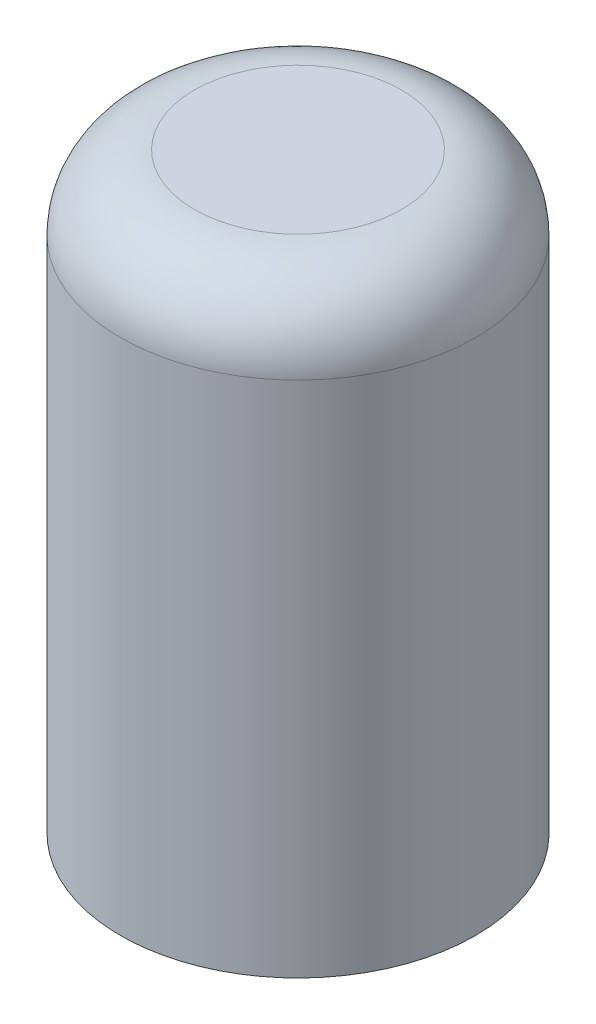
from build123d import *

# Parameters (mm, degrees)
SHELL5_T = -2


with BuildPart() as part:
    # Sketch1 → Revolve5 (revolve)
    with BuildSketch(Plane.XY, mode=Mode.PRIVATE) as revolve5_sk:
        with BuildLine():
            Line((0, 0), (60, 0))
            Line((60, 0), (60, 175))
            ThreePointArc((60, 175), (52.67766953, 192.67766953), (35, 200))
            Line((35, 200), (0, 200))
            Line((0, 200), (0, 0))
        make_face()
    revolve(revolve5_sk.sketch.rotate(Axis((0, 200, 0), (0, -1, 0)), 180), axis=Axis((0, 200, 0), (0, -1, 0)))

    # Shell5
    shell5_openings = [part.faces().sort_by_distance(p)[0] for p in [
        (0, 0, 0),
    ]]
    offset(amount=SHELL5_T, openings=shell5_openings, kind=Kind.INTERSECTION)


solid = part.part
